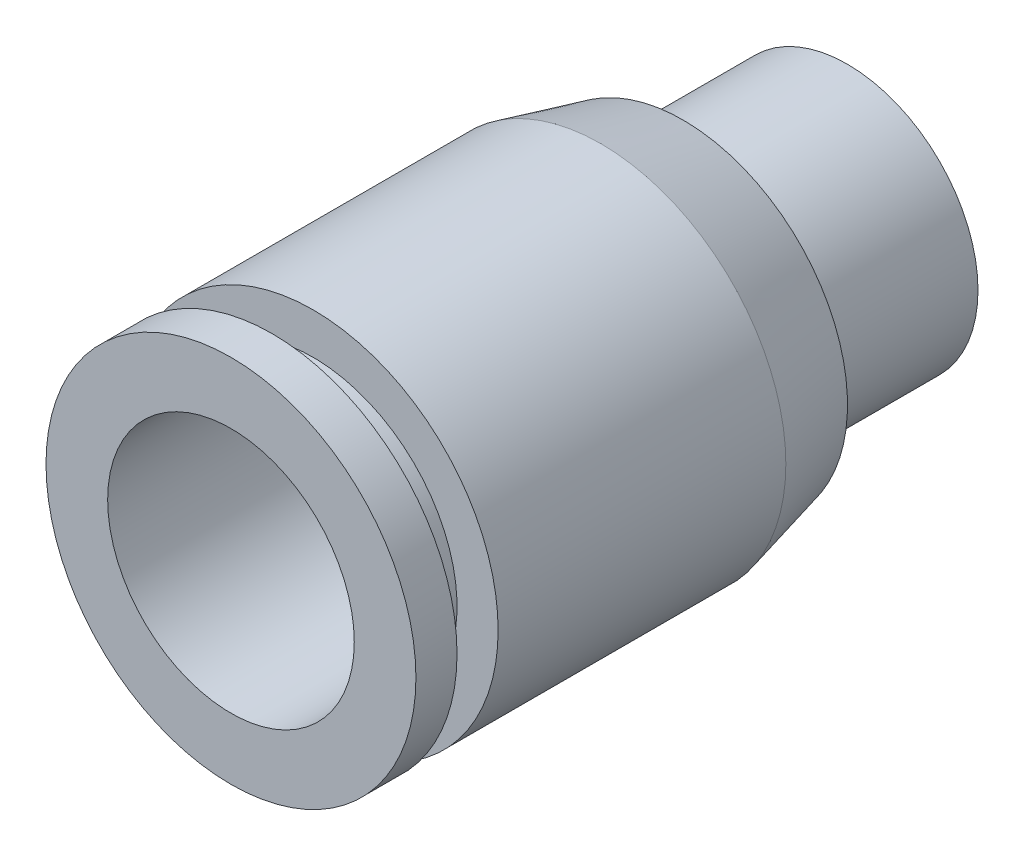
from build123d import *


with BuildPart() as part:
    # Sketch2 → Revolve1 (revolve)
    with BuildSketch(Plane(origin=(0, 0, 0), x_dir=(0, 0, -1), z_dir=(1, 0, 0)), mode=Mode.PRIVATE) as revolve1_sk:
        Polygon((-2, 3), (-11, 3), (-11, 4.5), (-10, 4.5), (-10, 3.5), (-9, 3.5), (-9, 4.5), (-2, 4.5), (0, 4), (0, 3.175), (4, 3.175), (4, 2), (-2, 2), align=None)
    revolve(revolve1_sk.sketch.rotate(Axis((0, 0, -4.7), (0, 0, 1)), 90), axis=Axis((0, 0, -4.7), (0, 0, 1)))


solid = part.part
